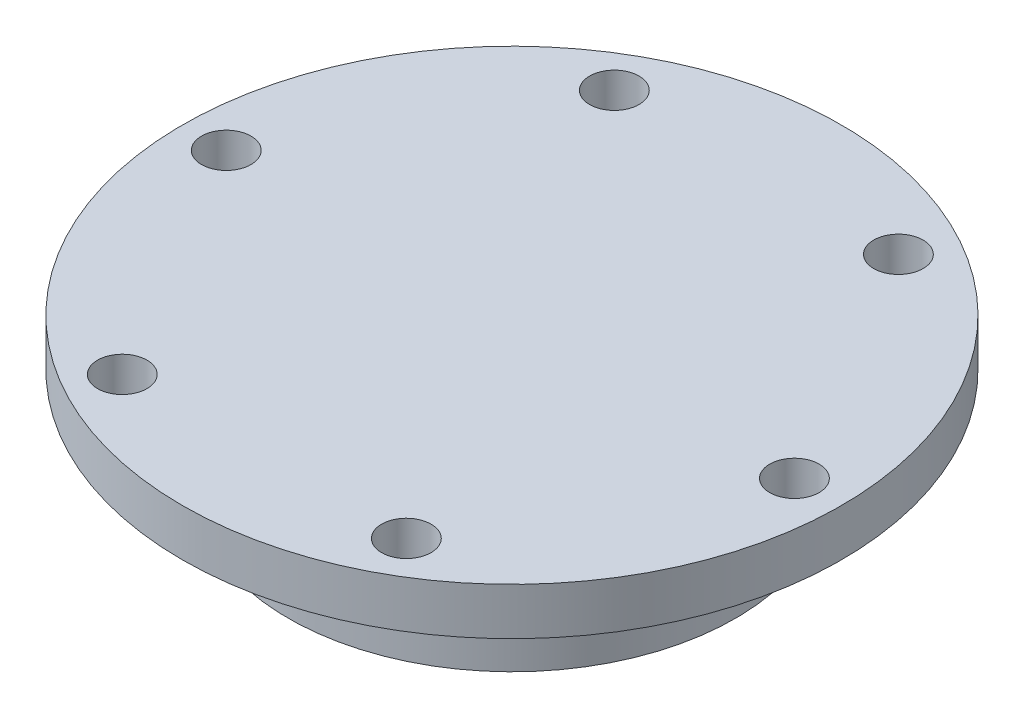
from build123d import *

# Parameters (mm, degrees)
CROQUIS1_R              = 70
SALIENTE_EXTRUIR1_DEPTH = 10
CROQUIS4_R              = 47.5
SALIENTE_EXTRUIR2_DEPTH = 22
MATRIZC1_COUNT          = 6


with BuildPart() as part:
    # Croquis1 → Saliente-Extruir1 (new body)
    with BuildSketch(Plane(origin=(0, 0, 0), x_dir=(1, 0, 0), z_dir=(0, 1, 0))):
        with Locations(Location((0, 0, 0), (0, 0, 270))):
            Circle(CROQUIS1_R)
    extrude(amount=SALIENTE_EXTRUIR1_DEPTH)

    # Croquis4 → Saliente-Extruir2 (add)
    with BuildSketch(Plane(origin=(0, 0, 0), x_dir=(-1, 0, 0), z_dir=(0, -1, 0))):
        with Locations(Location((0, 0, 0), (0, 0, 90))):
            Circle(CROQUIS4_R)
    extrude(amount=SALIENTE_EXTRUIR2_DEPTH)

    # Croquis6 → Taladro roscado M12x1.51 (revolve, cut)
    with BuildSketch(Plane(origin=(60, 10, 0), x_dir=(0, 0, 1), z_dir=(1, 0, 0))):
        Polygon((0, 0), (0, 34.65451825), (5.25, 31.5), (5.25, 0), align=None)
    taladro_roscado_m12x1_51 = revolve(axis=Axis((60, 16.35, 0), (0, -1, 0)), mode=Mode.SUBTRACT)

    # MatrizC1: Taladro roscado M12x1.51 ×6 about axis
    matrizc1_axis = Axis((-0.339409177, 0, 0), (0, 1, 0))
    for i in range(1, MATRIZC1_COUNT):
        add(taladro_roscado_m12x1_51.rotate(matrizc1_axis, i * 360 / MATRIZC1_COUNT), mode=Mode.SUBTRACT)


solid = part.part
